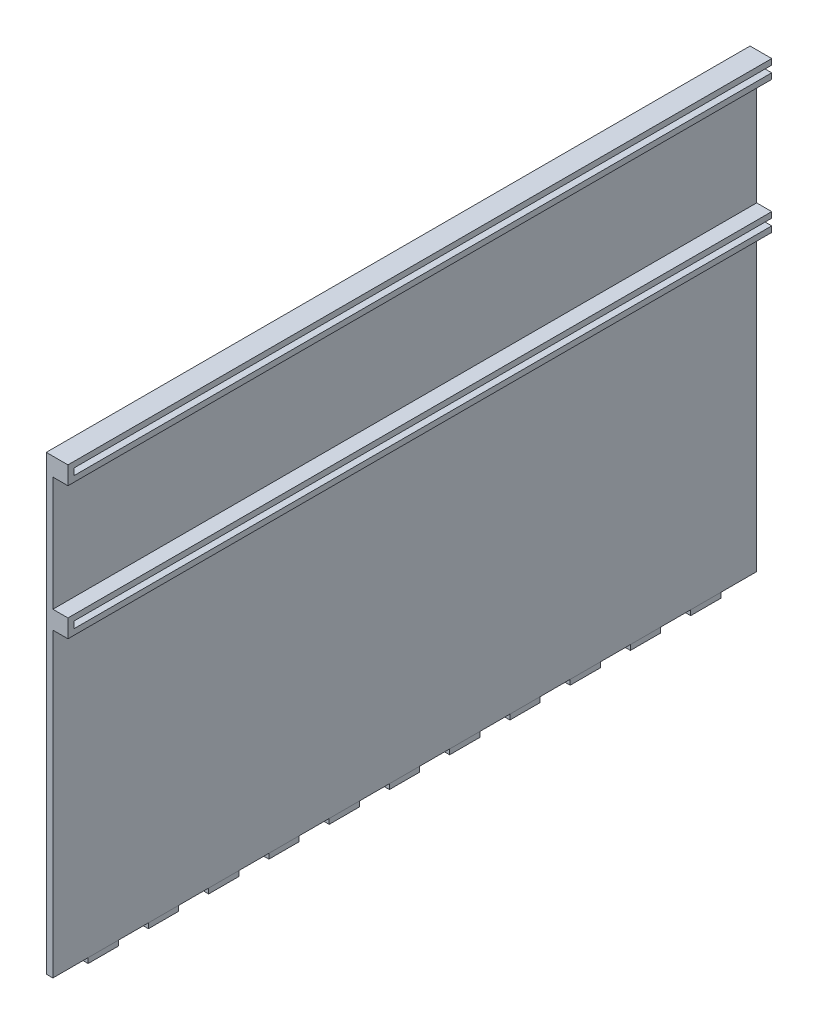
from build123d import *

# Parameters (mm, degrees)
SKETCH_4_W          = 233.6
SKETCH_4_H          = 150
EXTRUDE_2_DEPTH     = 2.2
SKETCH_6_W          = 2
SKETCH_6_H          = 10
EXTRUDE_3_DEPTH     = 1.8
SKETCH_7_W          = 233.6
SKETCH_7_H          = 6
EXTRUDE_4_DEPTH     = 5
SKETCH_8_W          = 114.8
SKETCH_8_H          = 2.2
SKETCH_8_W_2        = 116.8
SKETCH_8_W_3        = 231.6
CUT_EXTRUDE_1_DEPTH = 3


with BuildPart() as part:
    # 草图4 → 凸台-拉伸2 (new body)
    with BuildSketch(Plane(origin=(0, 0, 0), x_dir=(0, 0, -1), z_dir=(1, 0, 0))):
        Rectangle(SKETCH_4_W, SKETCH_4_H)
    extrude(amount=EXTRUDE_2_DEPTH)

    # 草图6 → 凸台-拉伸3 (add)
    with BuildSketch(Plane.XZ.offset(75)):
        with Locations((1.1, 20)):
            Rectangle(SKETCH_6_W, SKETCH_6_H)
        with Locations((1.1, 0)):
            Rectangle(SKETCH_6_W, SKETCH_6_H)
        with Locations((1.1, 40)):
            Rectangle(SKETCH_6_W, SKETCH_6_H)
        with Locations((1.1, 60)):
            Rectangle(SKETCH_6_W, SKETCH_6_H)
        with Locations((1.1, 80)):
            Rectangle(SKETCH_6_W, SKETCH_6_H)
        with Locations((1.1, 100)):
            Rectangle(SKETCH_6_W, SKETCH_6_H)
        with Locations((1.1, -20)):
            Rectangle(SKETCH_6_W, SKETCH_6_H)
        with Locations((1.1, -40)):
            Rectangle(SKETCH_6_W, SKETCH_6_H)
        with Locations((1.1, -60)):
            Rectangle(SKETCH_6_W, SKETCH_6_H)
        with Locations((1.1, -80)):
            Rectangle(SKETCH_6_W, SKETCH_6_H)
        with Locations((1.1, -100)):
            Rectangle(SKETCH_6_W, SKETCH_6_H)
    extrude(amount=EXTRUDE_3_DEPTH)

    # 草图7 → 凸台-拉伸4 (add)
    with BuildSketch(Plane(origin=(2.2, 0, 0), x_dir=(0, 0, -1), z_dir=(1, 0, 0))):
        with Locations((0, 28)):
            Rectangle(SKETCH_7_W, SKETCH_7_H)
        with Locations((0, 72)):
            Rectangle(SKETCH_7_W, SKETCH_7_H)
    extrude(amount=EXTRUDE_4_DEPTH)

    # 草图8 → 切除-拉伸1 (cut)
    with BuildSketch(Plane(origin=(7.2, 0, 0), x_dir=(0, 0, -1), z_dir=(1, 0, 0))):
        with Locations((-57.4, 28)):
            Rectangle(SKETCH_8_W, SKETCH_8_H)
        with Locations((58.4, 28)):
            Rectangle(SKETCH_8_W_2, SKETCH_8_H)
        with Locations((1, 72)):
            Rectangle(SKETCH_8_W_3, SKETCH_8_H)
    extrude(amount=-CUT_EXTRUDE_1_DEPTH, mode=Mode.SUBTRACT)


solid = part.part
